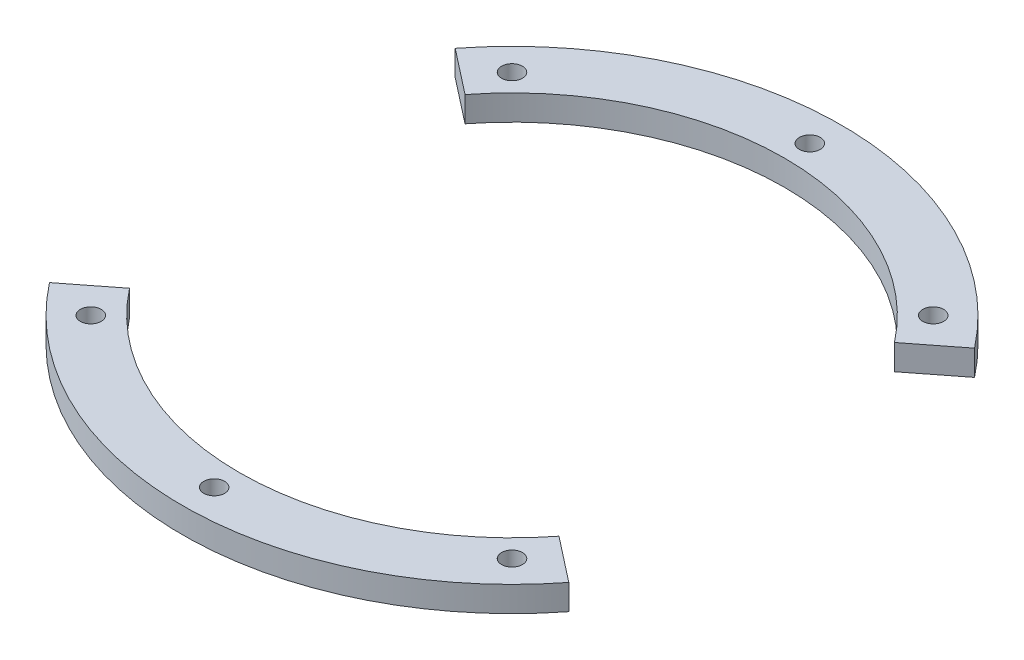
from build123d import *

# Parameters (mm, degrees)
SKETCH_1_R          = 52
SKETCH_1_R_2        = 43
SKETCH_1_R_3        = 1.65
EXTRUDE_1_DEPTH     = 4
CUT_EXTRUDE_2_DEPTH = 10


with BuildPart() as part:
    # 草图1 → 凸台-拉伸1 (new body)
    with BuildSketch(Plane(origin=(0, 0, 0), x_dir=(1, 0, 0), z_dir=(0, 1, 0))):
        with Locations(Location((0, 0, 0), (0, 0, 270))):
            Circle(SKETCH_1_R)
        with Locations(Location((0, 0, 0), (0, 0, 270))):
            Circle(SKETCH_1_R_2, mode=Mode.SUBTRACT)
        with Locations(Location((47, 0, 0), (0, 0, 270))):
            Circle(SKETCH_1_R_3, mode=Mode.SUBTRACT)
        with Locations(Location((33.234018716, -33.234018716, 0), (0, 0, 270))):
            Circle(SKETCH_1_R_3, mode=Mode.SUBTRACT)
        with Locations(Location((0, -47, 0), (0, 0, 270))):
            Circle(SKETCH_1_R_3, mode=Mode.SUBTRACT)
        with Locations(Location((-33.234018716, -33.234018716, 0), (0, 0, 270))):
            Circle(SKETCH_1_R_3, mode=Mode.SUBTRACT)
        with Locations(Location((-47, 0, 0), (0, 0, 270))):
            Circle(SKETCH_1_R_3, mode=Mode.SUBTRACT)
        with Locations(Location((-33.234018716, 33.234018716, 0), (0, 0, 270))):
            Circle(SKETCH_1_R_3, mode=Mode.SUBTRACT)
        with Locations(Location((0, 47, 0), (0, 0, 270))):
            Circle(SKETCH_1_R_3, mode=Mode.SUBTRACT)
        with Locations(Location((33.234018716, 33.234018716, 0), (0, 0, 270))):
            Circle(SKETCH_1_R_3, mode=Mode.SUBTRACT)
    extrude(amount=EXTRUDE_1_DEPTH)

    # 草图2 → 切除-拉伸2 (cut)
    with BuildSketch(Plane(origin=(0, 4, 0), x_dir=(1, 0, 0), z_dir=(0, 1, 0))):
        Polygon((32.7612153, 25.59586662), (0, 0), (32.7612153, -25.59586662), (53.158039477, -41.531612177), (53.158039477, 41.531612177), align=None)
        Polygon((-32.7612153, -25.59586662), (0, 0), (-32.7612153, 25.59586662), (-53.158039477, 41.531612177), (-53.158039477, -41.531612177), align=None)
    extrude(amount=-CUT_EXTRUDE_2_DEPTH, mode=Mode.SUBTRACT)


with BuildPart() as cut_extrude_2_piece_1:
    # of the separate pieces the step leaves, piece 1, a body of its own (cut_extrude_2_pieces)
    add(part.part.solids().sort_by_distance((-40.976559188, 0, 32.014396717))[0])


with BuildPart() as cut_extrude_2_piece_2:
    # of the separate pieces the step leaves, piece 2, a body of its own (cut_extrude_2_pieces)
    add(part.part.solids().sort_by_distance((40.976559188, 0, -32.014396717))[0])


solid = Compound([cut_extrude_2_piece_1.part, cut_extrude_2_piece_2.part])
